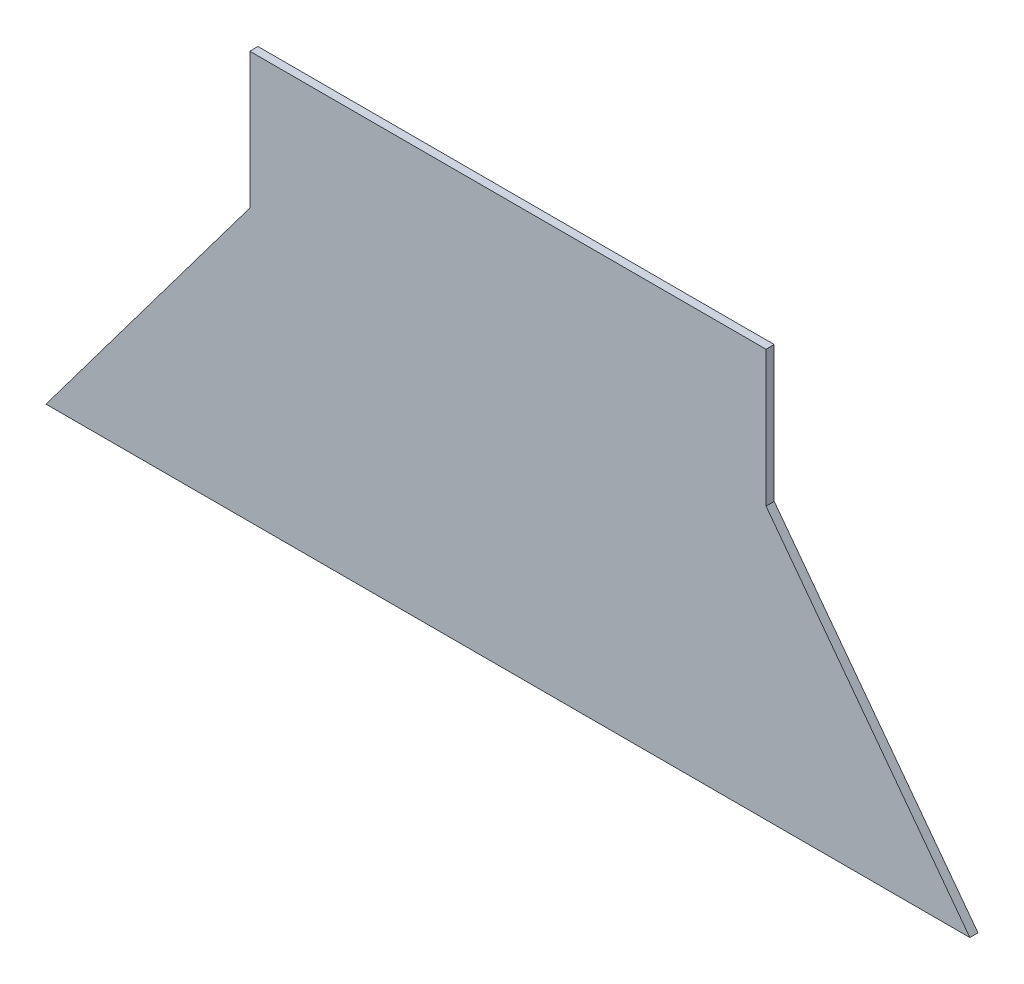
from build123d import *

# Parameters (mm, degrees)
RESSALTO_EXTRUS_O1_DEPTH = 6


with BuildPart() as part:
    # Esboço1 → Ressalto-extrusão1 (new body)
    with BuildSketch(Plane.XY):
        Polygon((0, 0), (150, 200), (150, 300), (530, 300), (530, 200), (680, 0), align=None)
    extrude(amount=RESSALTO_EXTRUS_O1_DEPTH)


solid = part.part
